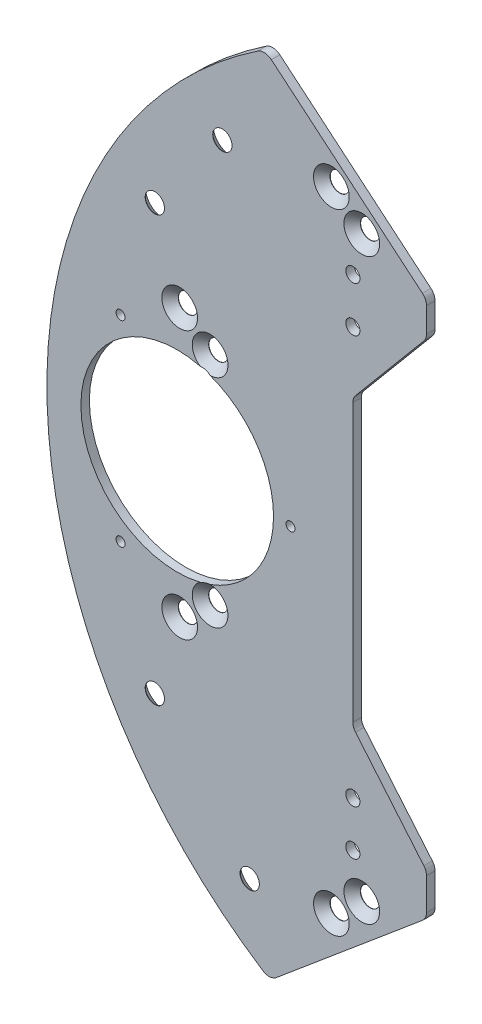
from build123d import *

# Parameters (mm, degrees)
RESSALTO_EXTRUS_O1_DEPTH                           = 1.5
ESBO_O2_R                                          = 17
CORTE_EXTRUS_O1_DEPTH                              = 1.5
FURO_ROSCADO_DE_M21_D                              = 1.6
CORTE_EXTRUS_O3_DEPTH                              = 1.5
ESCAREADO_PARA_PARAFUSO_COM_CABE_A_E_2_COUNT       = 2
ESCAREADO_PARA_PARAFUSO_COM_CABE_A_E_2_PITCH       = 7
ESCAREADO_PARA_PARAFUSO_COM_CABE_A_E_3_COUNT       = 2
ESCAREADO_PARA_PARAFUSO_COM_CABE_A_E_3_PITCH       = 42.234139035
ESCAREADO_PARA_PARAFUSO_COM_CABE_A_E_4_COUNT       = 2
ESCAREADO_PARA_PARAFUSO_COM_CABE_A_E_4_PITCH       = 41.65
ESCAREADO_PARA_PARAFUSO_COM_CABE_A_E_5_COUNT       = 2
ESCAREADO_PARA_PARAFUSO_COM_CABE_A_E_5_PITCH       = 83.568902959
ESCAREADO_PARA_PARAFUSO_COM_CABE_A_E_6_COUNT       = 2
ESCAREADO_PARA_PARAFUSO_COM_CABE_A_E_6_PITCH       = 81.286400606
ESCAREADO_PARA_PARAFUSO_COM_CABE_A_E_7_COUNT       = 2
ESCAREADO_PARA_PARAFUSO_COM_CABE_A_E_7_PITCH       = 47.258735882
ESCAREADO_PARA_PARAFUSO_COM_CABE_A_E_8_COUNT       = 2
ESCAREADO_PARA_PARAFUSO_COM_CABE_A_E_8_PITCH       = 43.094146922
ESCAREADO_PARA_PARAFUSO_COM_CABE_A_E_9_D           = 3.4
ESCAREADO_PARA_PARAFUSO_COM_CABE_A_E_9_DEPTH       = 7.25
ESCAREADO_PARA_PARAFUSO_COM_CABE_A_E_9_CSINK_D     = 6.3
ESCAREADO_PARA_PARAFUSO_COM_CABE_A_E_9_CSINK_ANGLE = 90
ESCAREADO_PARA_PARAFUSO_COM_CABE_A_E_9_TIP         = 1.021463052
CORTE_EXTRUS_O7_DEPTH                              = 122.865704775
CORTE_EXTRUS_O8_DEPTH                              = 114.698293533
FILETE1_R                                          = 2
BROCA_DE_ROSQUEAR_PARA_TARRAXA_DE_M31_D            = 2.5


with BuildPart() as part:
    # Esboço1 → Ressalto-extrusão1 (new body)
    with BuildSketch(Plane.XY):
        with BuildLine():
            Line((-17, 85.322916031), (-17, -85.322916031))
            ThreePointArc((-17, -85.322916031), (-87, 0), (-17, 85.322916031))
        make_face()
    extrude(amount=RESSALTO_EXTRUS_O1_DEPTH)

    # Esboço2 → Corte-extrusão1 (cut)
    with BuildSketch(Plane.XY.offset(1.5)):
        with Locations((-61, 0)):
            Circle(ESBO_O2_R)
    extrude(amount=-CORTE_EXTRUS_O1_DEPTH, mode=Mode.SUBTRACT)

    # Furo roscado de M21 (through all)
    with Locations(Plane(origin=(-71, 17.320508076, 1.5), x_dir=(1, 0, 0), z_dir=(0, 0, 1))):
        with Locations((0, 0), (30, -17.320508076), (0, -34.641016152)):
            Hole(FURO_ROSCADO_DE_M21_D / 2)

    # Esboço6 → Corte-extrusão3 (cut)
    with BuildSketch(Plane.XY.offset(1.5)):
        with BuildLine():
            Line((-30, -24.445048467), (-30, 24.445048467))
            ThreePointArc((-30, 24.445048467), (-29.879385242, 25.129088753), (-29.532088886, 25.730623686))
            Line((-29.532088886, 25.730623686), (-17, 40.665785639))
            Line((-17, 40.665785639), (-17, -40.665785639))
            Line((-17, -40.665785639), (-29.532088886, -25.730623686))
            ThreePointArc((-29.532088886, -25.730623686), (-29.879385242, -25.129088753), (-30, -24.445048467))
        make_face()
    extrude(amount=-CORTE_EXTRUS_O3_DEPTH, mode=Mode.SUBTRACT)

    # Esboço11 → Escareado para parafuso com cabe_a escar (revolve, cut)
    with BuildSketch(Plane(origin=(-60.558332829, -23.629367941, 1.5), x_dir=(0, -1, 0), z_dir=(1, 0, 0))):
        Polygon((0, 0), (0, 1.5), (1.7, 1.5), (1.7, 1.45), (3.15, 0), align=None)
    escareado_para_parafuso_com_cabe_a_escar = revolve(axis=Axis((-60.558332829, -23.629367941, 7.85), (0, 0, -1)), mode=Mode.SUBTRACT)

    # Escareado para parafuso com cabe_a e 2: Escareado para parafuso com cabe_a escar ×2
    with Locations(*[Vector(0.7660444431189771, 0.6427876096865406, 0) * (i * ESCAREADO_PARA_PARAFUSO_COM_CABE_A_E_2_PITCH) for i in range(1, ESCAREADO_PARA_PARAFUSO_COM_CABE_A_E_2_COUNT)]):
        add(escareado_para_parafuso_com_cabe_a_escar, mode=Mode.SUBTRACT)

    # Escareado para parafuso com cabe_a e 3: Escareado para parafuso com cabe_a escar ×2
    with Locations(*[Vector(0.7608635047324315, -0.6489119564057063, 0) * (i * ESCAREADO_PARA_PARAFUSO_COM_CABE_A_E_3_PITCH) for i in range(1, ESCAREADO_PARA_PARAFUSO_COM_CABE_A_E_3_COUNT)]):
        add(escareado_para_parafuso_com_cabe_a_escar, mode=Mode.SUBTRACT)

    # Escareado para parafuso com cabe_a e 4: Escareado para parafuso com cabe_a escar ×2
    with Locations(*[Vector(0.6427876096865411, -0.7660444431189766, 0) * (i * ESCAREADO_PARA_PARAFUSO_COM_CABE_A_E_4_PITCH) for i in range(1, ESCAREADO_PARA_PARAFUSO_COM_CABE_A_E_4_COUNT)]):
        add(escareado_para_parafuso_com_cabe_a_escar, mode=Mode.SUBTRACT)

    # Escareado para parafuso com cabe_a e 5: Escareado para parafuso com cabe_a escar ×2
    with Locations(*[Vector(0.3203596433075423, 0.9472959933093058, 0) * (i * ESCAREADO_PARA_PARAFUSO_COM_CABE_A_E_5_PITCH) for i in range(1, ESCAREADO_PARA_PARAFUSO_COM_CABE_A_E_5_COUNT)]):
        add(escareado_para_parafuso_com_cabe_a_escar, mode=Mode.SUBTRACT)

    # Escareado para parafuso com cabe_a e 6: Escareado para parafuso com cabe_a escar ×2
    with Locations(*[Vector(0.3953233850400935, 0.9185420084244608, 0) * (i * ESCAREADO_PARA_PARAFUSO_COM_CABE_A_E_6_PITCH) for i in range(1, ESCAREADO_PARA_PARAFUSO_COM_CABE_A_E_6_COUNT)]):
        add(escareado_para_parafuso_com_cabe_a_escar, mode=Mode.SUBTRACT)

    # Escareado para parafuso com cabe_a e 7: Escareado para parafuso com cabe_a escar ×2
    with Locations(*[(0, i * ESCAREADO_PARA_PARAFUSO_COM_CABE_A_E_7_PITCH, 0) for i in range(1, ESCAREADO_PARA_PARAFUSO_COM_CABE_A_E_7_COUNT)]):
        add(escareado_para_parafuso_com_cabe_a_escar, mode=Mode.SUBTRACT)

    # Escareado para parafuso com cabe_a e 8: Escareado para parafuso com cabe_a escar ×2
    with Locations(*[Vector(0.12443246902051158, 0.9922280789483129, 0) * (i * ESCAREADO_PARA_PARAFUSO_COM_CABE_A_E_8_PITCH) for i in range(1, ESCAREADO_PARA_PARAFUSO_COM_CABE_A_E_8_COUNT)]):
        add(escareado_para_parafuso_com_cabe_a_escar, mode=Mode.SUBTRACT)

    # Escareado para parafuso com cabe_a e 9
    with Locations(Plane(origin=(-48.209070726, -57.453333234, 0), x_dir=(-1, 0, 0), z_dir=(0, 0, -1))):
        with Locations((0, 0), (16.742834558, 19.953333234), (16.742834558, 94.953333234), (4.823937863, 110.486341823)):
            CounterSinkHole(ESCAREADO_PARA_PARAFUSO_COM_CABE_A_E_9_D / 2, ESCAREADO_PARA_PARAFUSO_COM_CABE_A_E_9_CSINK_D / 2, depth=ESCAREADO_PARA_PARAFUSO_COM_CABE_A_E_9_DEPTH, counter_sink_angle=ESCAREADO_PARA_PARAFUSO_COM_CABE_A_E_9_CSINK_ANGLE)
            with Locations((0, 0, -(ESCAREADO_PARA_PARAFUSO_COM_CABE_A_E_9_DEPTH + ESCAREADO_PARA_PARAFUSO_COM_CABE_A_E_9_TIP / 2))):  # 118° drill point
                Cone(0, ESCAREADO_PARA_PARAFUSO_COM_CABE_A_E_9_D / 2, ESCAREADO_PARA_PARAFUSO_COM_CABE_A_E_9_TIP, mode=Mode.SUBTRACT)

    # Esboço19 → Corte-extrusão7 (cut, through all)
    with BuildSketch(Plane(origin=(0, 0, 0), x_dir=(-1, 0, 0), z_dir=(0, 0, -1))):
        Polygon((31.215078447, 58.599296769), (17, 46.671429688), (17, 85.322916031), (63.063047709, 85.322916031), align=None)
        Polygon((30.572290837, -59.365341213), (17, -47.976836977), (17, -85.322916031), (61.507323882, -85.322916031), align=None)
    extrude(amount=-CORTE_EXTRUS_O7_DEPTH, mode=Mode.SUBTRACT)

    # Esboço20 → Corte-extrusão8 (cut, through all)
    with BuildSketch(Plane(origin=(0, 0, 0), x_dir=(-1, 0, 0), z_dir=(0, 0, -1))):
        with BuildLine():
            Line((47.91785698, 72.614592076), (45.51622644, 70.599384776))
            ThreePointArc((45.51622644, 70.599384776), (83.998363098, -0.524401402), (44.631209662, -71.162174813))
            Line((44.631209662, -71.162174813), (47.04198176, -73.185052792))
            ThreePointArc((47.04198176, -73.185052792), (86.998430183, -0.522633435), (47.91785698, 72.614592076))
        make_face()
    extrude(amount=-CORTE_EXTRUS_O8_DEPTH, mode=Mode.SUBTRACT)

    # Filete1
    filete1_edges = [part.edges().sort_by_distance(p)[0] for p in [
        (-17, 46.671429688, 0.75),
        (-17, -47.976836977, 0.75),
        (-45.51622644, 70.599384776, 0.75),
        (-44.631209662, -71.162174813, 0.75),
        (-17, 40.665785639, 0.75),
        (-17, -40.665785639, 0.75),
    ]]
    fillet(filete1_edges, radius=FILETE1_R)

    # Broca de rosquear para tarraxa de M31 (through all)
    with Locations(Plane(origin=(-30, -44, 1.5), x_dir=(1, 0, 0), z_dir=(0, 0, 1))):
        with Locations((0, 0), (0, 8), (0, 88), (0, 80)):
            Hole(BROCA_DE_ROSQUEAR_PARA_TARRAXA_DE_M31_D / 2)


solid = part.part
